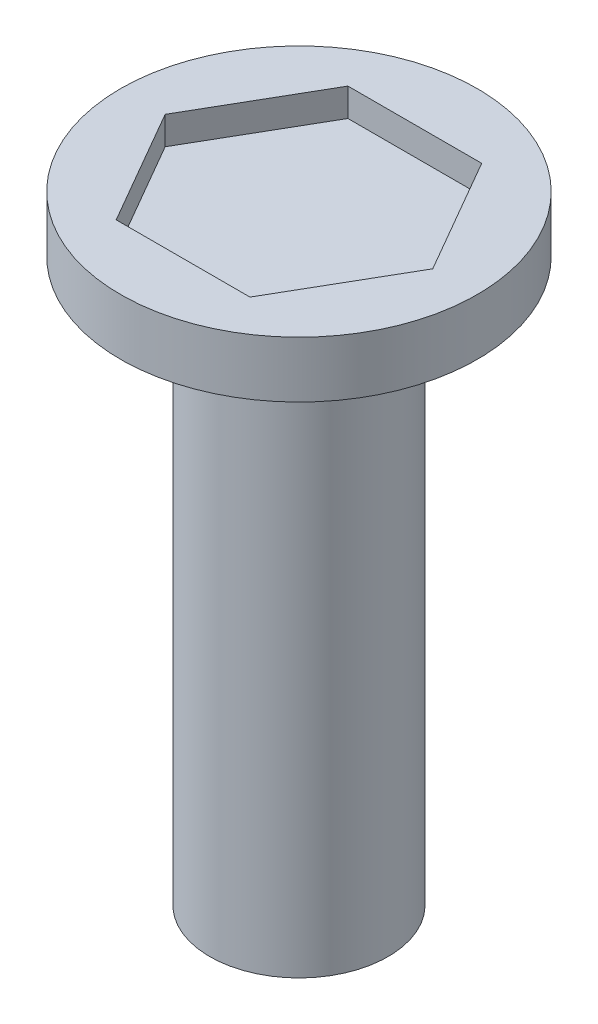
from build123d import *

# Parameters (mm, degrees)
CUT_EXTRUDE1_DEPTH = 0.5


with BuildPart() as part:
    # Sketch1 → Revolve1 (revolve)
    with BuildSketch(Plane.XY):
        Polygon((0, 0), (3.175, 0), (3.175, -11), (1.5875, -11), (1.5875, -1), (0, -1), align=None)
    revolve(axis=Axis((3.175, 0, 0), (0, -1, 0)))

    # Sketch2 → Cut-Extrude1 (cut)
    with BuildSketch(Plane(origin=(0, 0, 0), x_dir=(1, 0, 0), z_dir=(0, 1, 0))):
        Polygon((5.55625, 0), (4.365625, 2.062222993), (1.984375, 2.062222993), (0.79375, 0), (1.984375, -2.062222993), (4.365625, -2.062222993), align=None)
    extrude(amount=-CUT_EXTRUDE1_DEPTH, mode=Mode.SUBTRACT)


solid = part.part
